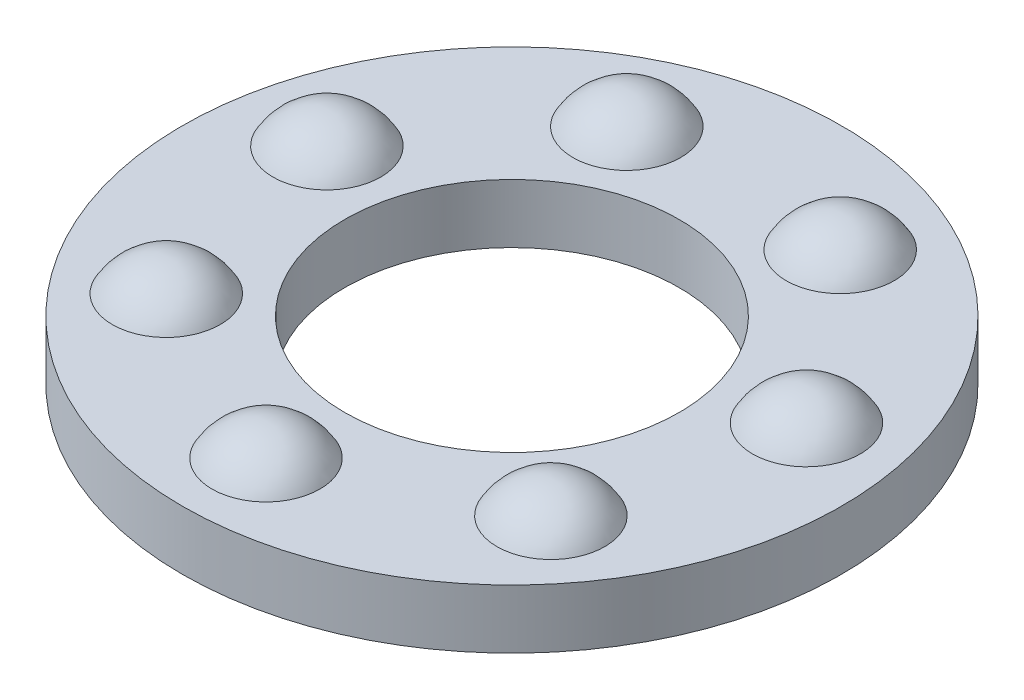
from build123d import *

# Parameters (mm, degrees)
SKETCH2_R           = 3.35
SKETCH2_R_2         = 1.7
BOSS_EXTRUDE1_DEPTH = 0.3
CIRPATTERN2_COUNT   = 7


with BuildPart() as part:
    # Sketch1 → Revolve1 (revolve)
    with BuildSketch(Plane(origin=(0, 0, 0), x_dir=(0, 0, -1), z_dir=(1, 0, 0))):
        with BuildLine():
            Line((-2.5, 0.625), (-2.5, -0.625))
            ThreePointArc((-2.5, -0.625), (-3.125, 0), (-2.5, 0.625))
        make_face()
    revolve1 = revolve(axis=Axis((0, 0.625, 2.5), (0, -1, 0)))

    # Sketch2 → Boss-Extrude1 (add, symmetric)
    with BuildSketch(Plane(origin=(0, 0, 0), x_dir=(1, 0, 0), z_dir=(0, 1, 0))):
        Circle(SKETCH2_R)
        Circle(SKETCH2_R_2, mode=Mode.SUBTRACT)
    extrude(amount=BOSS_EXTRUDE1_DEPTH, both=True)

    # CirPattern2: Revolve1 ×7 about axis
    cirpattern2_axis = Axis((0, 0.6875, 0), (0, -1, 0))
    for i in range(1, CIRPATTERN2_COUNT):
        add(revolve1.rotate(cirpattern2_axis, i * 360 / CIRPATTERN2_COUNT))


solid = part.part
